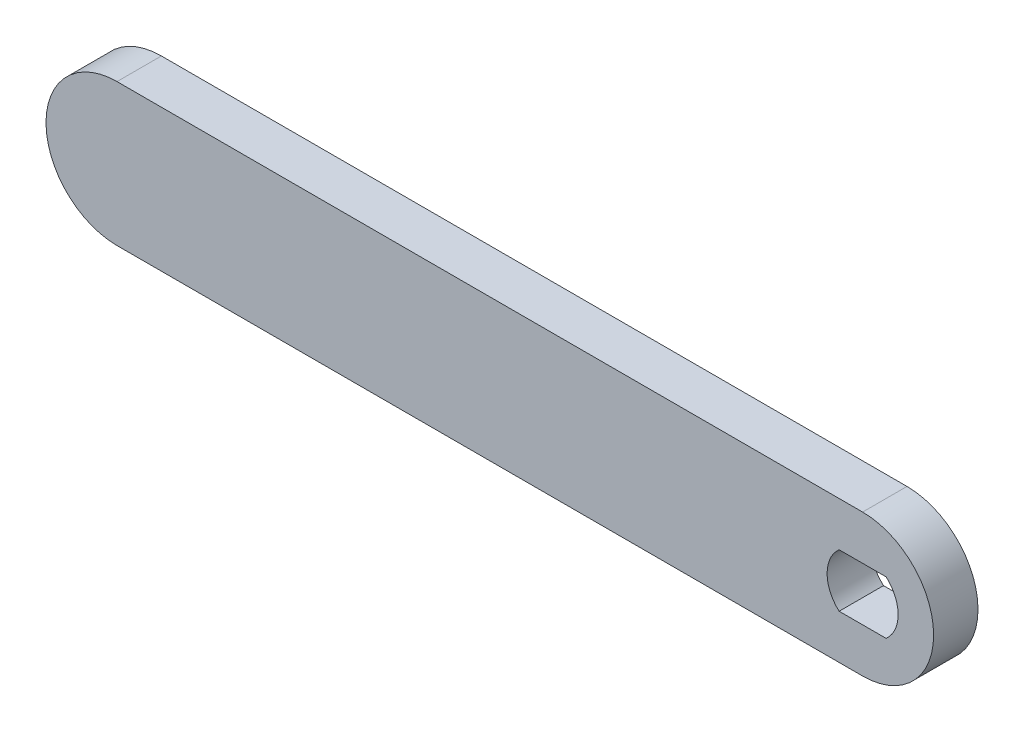
from build123d import *

# Parameters (mm, degrees)
SKETCH1_R           = 8
SKETCH1_R_2         = 4
BOSS_EXTRUDE1_DEPTH = 5


with BuildPart() as part:
    # Sketch1 → Boss-Extrude1 (new body)
    # profile 1 of 5: a face of its own
    with BuildSketch(Plane.XY):
        with Locations((-84, 0)):
            Circle(SKETCH1_R)
    # profile 2 of 5: a face of its own
    with BuildSketch(Plane.XY):
        with BuildLine():
            ThreePointArc((0, -8), (-8, 0), (0, 8))
            Line((0, 8), (-84, 8))
            ThreePointArc((-84, 8), (-78.343145751, 5.656854249), (-76, 0))
            ThreePointArc((-76, 0), (-78.343145751, -5.656854249), (-84, -8))
            Line((-84, -8), (0, -8))
        make_face()
    # profile 3 of 5: a face of its own
    with BuildSketch(Plane.XY):
        Circle(SKETCH1_R)
        Circle(SKETCH1_R_2, mode=Mode.SUBTRACT)
    # profile 4 of 5: a face of its own
    with BuildSketch(Plane.XY):
        with BuildLine():
            Line((-2.645751311, 3), (2.645751311, 3))
            ThreePointArc((2.645751311, 3), (0, 4), (-2.645751311, 3))
        make_face()
    # profile 5 of 5: a face of its own
    with BuildSketch(Plane.XY):
        with BuildLine():
            ThreePointArc((-2.645751311, -3), (0, -4), (2.645751311, -3))
            Line((2.645751311, -3), (-2.645751311, -3))
        make_face()
    extrude(amount=-BOSS_EXTRUDE1_DEPTH)


solid = part.part
